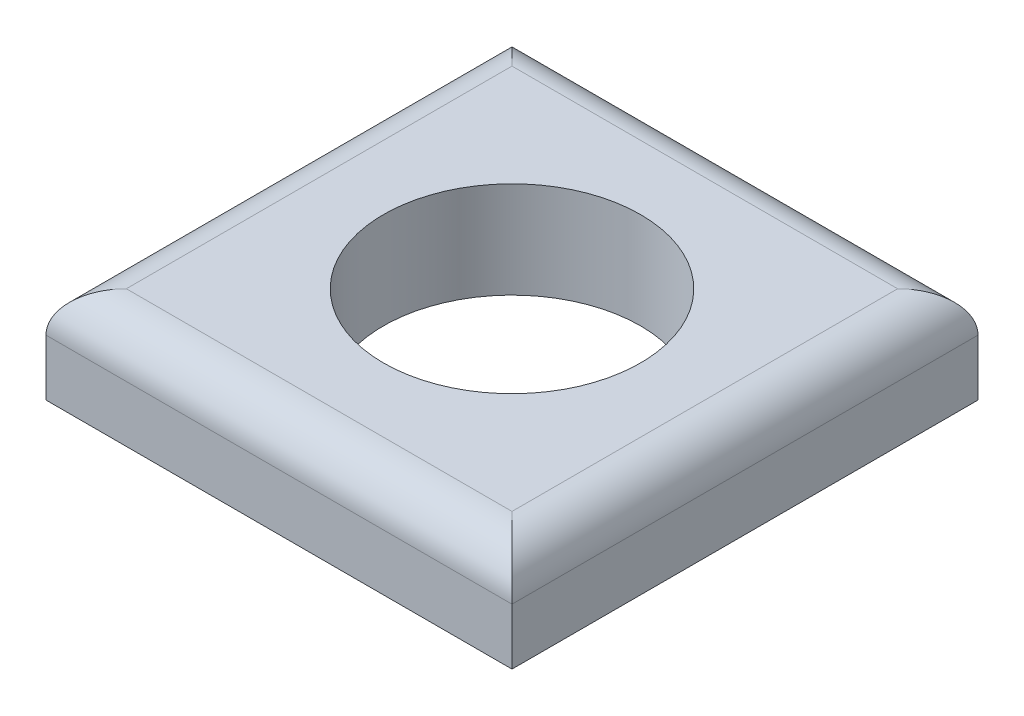
from build123d import *

# Parameters (mm, degrees)
SKETCH_1_W          = 5.8
SKETCH_1_H          = 5.8
EXTRUDE_1_DEPTH     = 1.2
SKETCH_2_R          = 1.6
CUT_EXTRUDE_1_DEPTH = 1.2
FILLET_1_R          = 0.5


with BuildPart() as part:
    # 草图1 → 拉伸1 (new body)
    with BuildSketch(Plane(origin=(0, 0, 0), x_dir=(1, 0, 0), z_dir=(0, 1, 0))):
        Rectangle(SKETCH_1_W, SKETCH_1_H)
    extrude(amount=EXTRUDE_1_DEPTH)

    # 草图2 → 切除-拉伸1 (cut)
    with BuildSketch(Plane(origin=(0, 1.2, 0), x_dir=(-1, 0, 0), z_dir=(0, 1, 0))):
        with Locations(Location((0, 0, 0), (0, 0, 90))):
            Circle(SKETCH_2_R)
    extrude(amount=-CUT_EXTRUDE_1_DEPTH, mode=Mode.SUBTRACT)

    # 圆角1
    fillet_1_edges = [part.edges().sort_by_distance(p)[0] for p in [
        (2.9, 1.2, 0),
        (0, 1.2, -2.9),
        (-2.9, 1.2, 0),
        (0, 1.2, 2.9),
    ]]
    fillet(fillet_1_edges, radius=FILLET_1_R)


solid = part.part
